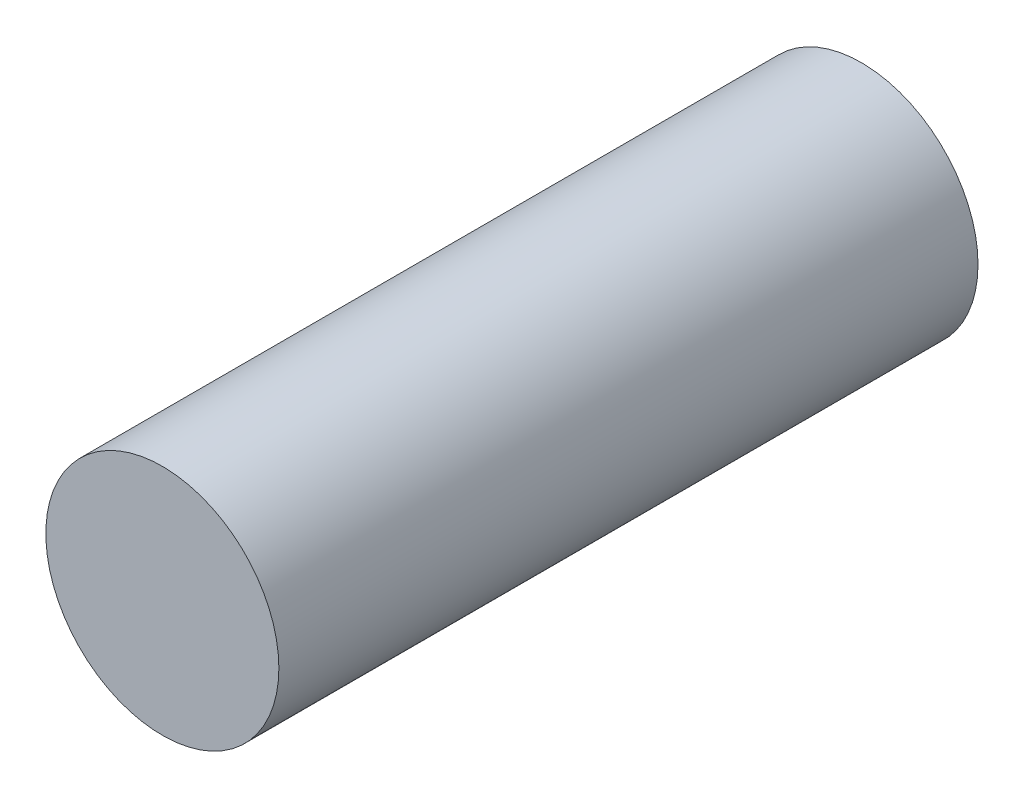
from build123d import *

# Parameters (mm, degrees)
SKETCH_1_R      = 5
EXTRUDE_1_DEPTH = 30


with BuildPart() as part:
    # 草图1 → 凸台-拉伸1 (new body)
    with BuildSketch(Plane.XY):
        with Locations((-42.501735051, -93.782849066)):
            Circle(SKETCH_1_R)
    extrude(amount=-EXTRUDE_1_DEPTH)


solid = part.part
